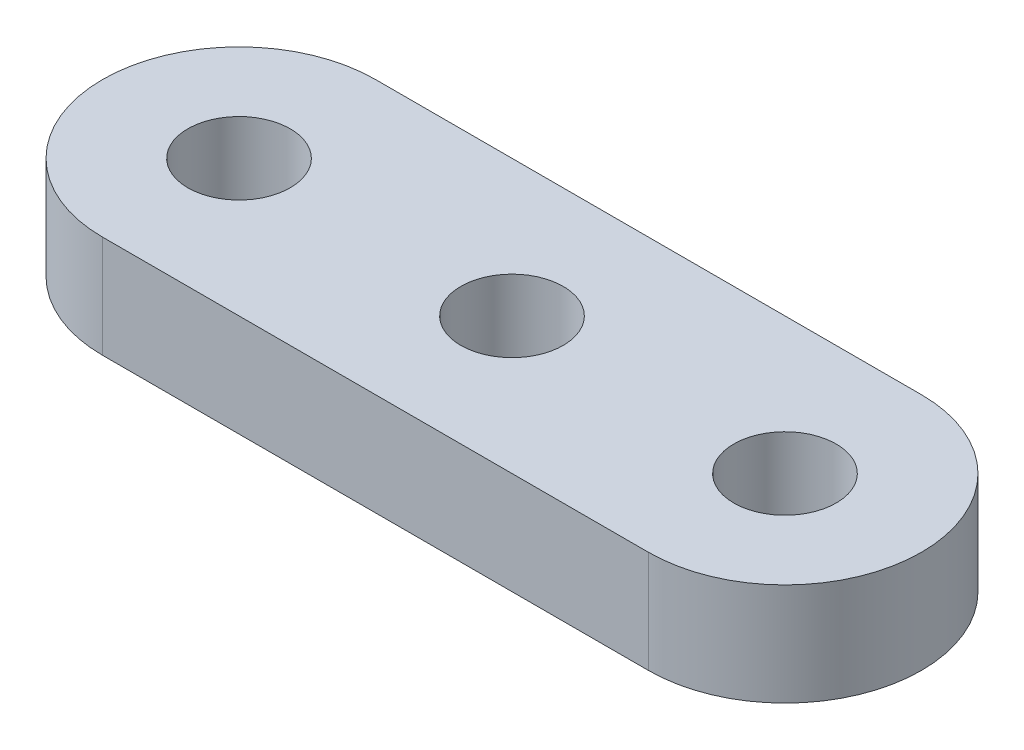
from build123d import *

# Parameters (mm, degrees)
SKETCH2_R             = 1.5
BOSS_EXTRUDE2_DEPTH   = 3
BOSS_EXTRUDE2_2_DEPTH = 3
BOSS_EXTRUDE2_3_DEPTH = 3
BOSS_EXTRUDE2_4_DEPTH = 3
BOSS_EXTRUDE2_5_DEPTH = 3
BOSS_EXTRUDE2_6_DEPTH = 3
BOSS_EXTRUDE2_7_DEPTH = 3
BOSS_EXTRUDE2_8_DEPTH = 3
BOSS_EXTRUDE2_9_DEPTH = 3
SKETCH3_W             = 64.685996336
SKETCH3_H             = 8.346580173
CUT_EXTRUDE1_DEPTH    = 10


with BuildPart() as part:
    # Sketch2 → Boss-Extrude2 (new body)
    with BuildSketch(Plane(origin=(0, 0, 0), x_dir=(1, 0, 0), z_dir=(0, 1, 0))):
        with Locations(Location((24, 0, 0), (0, 0, 270))):
            Circle(SKETCH2_R)
    extrude(amount=BOSS_EXTRUDE2_DEPTH)


with BuildPart() as body_2:
    # Sketch2 → Boss-Extrude2 2 (new body)
    with BuildSketch(Plane(origin=(0, 0, 0), x_dir=(1, 0, 0), z_dir=(0, 1, 0))):
        with Locations(Location((32, 0, 0), (0, 0, 270))):
            Circle(SKETCH2_R)
    extrude(amount=BOSS_EXTRUDE2_2_DEPTH)


with BuildPart() as body_3:
    # Sketch2 → Boss-Extrude2 3 (new body)
    with BuildSketch(Plane(origin=(0, 0, 0), x_dir=(1, 0, 0), z_dir=(0, 1, 0))):
        with Locations(Location((40, 0, 0), (0, 0, 270))):
            Circle(SKETCH2_R)
    extrude(amount=BOSS_EXTRUDE2_3_DEPTH)


with BuildPart() as body_4:
    # Sketch2 → Boss-Extrude2 4 (new body)
    with BuildSketch(Plane(origin=(0, 0, 0), x_dir=(1, 0, 0), z_dir=(0, 1, 0))):
        with Locations(Location((48, 0, 0), (0, 0, 270))):
            Circle(SKETCH2_R)
    extrude(amount=BOSS_EXTRUDE2_4_DEPTH)


with BuildPart() as body_5:
    # Sketch2 → Boss-Extrude2 5 (new body)
    with BuildSketch(Plane(origin=(0, 0, 0), x_dir=(1, 0, 0), z_dir=(0, 1, 0))):
        with Locations(Location((56, 0, 0), (0, 0, 270))):
            Circle(SKETCH2_R)
    extrude(amount=BOSS_EXTRUDE2_5_DEPTH)


with BuildPart() as body_6:
    # Sketch2 → Boss-Extrude2 6 (new body)
    with BuildSketch(Plane(origin=(0, 0, 0), x_dir=(1, 0, 0), z_dir=(0, 1, 0))):
        with Locations(Location((64, 0, 0), (0, 0, 270))):
            Circle(SKETCH2_R)
    extrude(amount=BOSS_EXTRUDE2_6_DEPTH)


with BuildPart() as body_7:
    # Sketch2 → Boss-Extrude2 7 (new body)
    with BuildSketch(Plane(origin=(0, 0, 0), x_dir=(1, 0, 0), z_dir=(0, 1, 0))):
        with Locations(Location((72, 0, 0), (0, 0, 270))):
            Circle(SKETCH2_R)
    extrude(amount=BOSS_EXTRUDE2_7_DEPTH)


with BuildPart() as body_8:
    # Sketch2 → Boss-Extrude2 8 (new body)
    with BuildSketch(Plane(origin=(0, 0, 0), x_dir=(1, 0, 0), z_dir=(0, 1, 0))):
        with Locations(Location((80, 0, 0), (0, 0, 270))):
            Circle(SKETCH2_R)
    extrude(amount=BOSS_EXTRUDE2_8_DEPTH)


with BuildPart() as body_9:
    # Sketch2 → Boss-Extrude2 9 (new body)
    with BuildSketch(Plane(origin=(0, 0, 0), x_dir=(1, 0, 0), z_dir=(0, 1, 0))):
        with BuildLine():
            Line((0, 4), (16, 4))
            ThreePointArc((16, 4), (20, 0), (16, -4))
            Line((16, -4), (0, -4))
            ThreePointArc((0, -4), (-4, 0), (0, 4))
        make_face()
        with Locations(Location((0, 0, 0), (0, 0, 270))):
            Circle(SKETCH2_R, mode=Mode.SUBTRACT)
        with Locations(Location((8, 0, 0), (0, 0, 270))):
            Circle(SKETCH2_R, mode=Mode.SUBTRACT)
        with Locations(Location((16, 0, 0), (0, 0, 270))):
            Circle(SKETCH2_R, mode=Mode.SUBTRACT)
    extrude(amount=BOSS_EXTRUDE2_9_DEPTH)


with BuildPart() as cut_extrude1_tool:
    # Sketch3 → Cut-Extrude1 (new body)
    with BuildSketch(Plane.XZ):
        with Locations((54.20188262, -0.75152397)):
            Rectangle(SKETCH3_W, SKETCH3_H)
    extrude(amount=-CUT_EXTRUDE1_DEPTH)


with BuildPart() as part_1:
    add(part.part)

    # Cut-Extrude1: cut by cut_extrude1_tool
    add(cut_extrude1_tool.part, mode=Mode.SUBTRACT)


with BuildPart() as body_2_1:
    add(body_2.part)

    # Cut-Extrude1: cut by cut_extrude1_tool
    add(cut_extrude1_tool.part, mode=Mode.SUBTRACT)


with BuildPart() as body_3_1:
    add(body_3.part)

    # Cut-Extrude1: cut by cut_extrude1_tool
    add(cut_extrude1_tool.part, mode=Mode.SUBTRACT)


with BuildPart() as body_4_1:
    add(body_4.part)

    # Cut-Extrude1: cut by cut_extrude1_tool
    add(cut_extrude1_tool.part, mode=Mode.SUBTRACT)


with BuildPart() as body_5_1:
    add(body_5.part)

    # Cut-Extrude1: cut by cut_extrude1_tool
    add(cut_extrude1_tool.part, mode=Mode.SUBTRACT)


with BuildPart() as body_6_1:
    add(body_6.part)

    # Cut-Extrude1: cut by cut_extrude1_tool
    add(cut_extrude1_tool.part, mode=Mode.SUBTRACT)


with BuildPart() as body_7_1:
    add(body_7.part)

    # Cut-Extrude1: cut by cut_extrude1_tool
    add(cut_extrude1_tool.part, mode=Mode.SUBTRACT)


with BuildPart() as body_8_1:
    add(body_8.part)

    # Cut-Extrude1: cut by cut_extrude1_tool
    add(cut_extrude1_tool.part, mode=Mode.SUBTRACT)


solid = body_9.part
